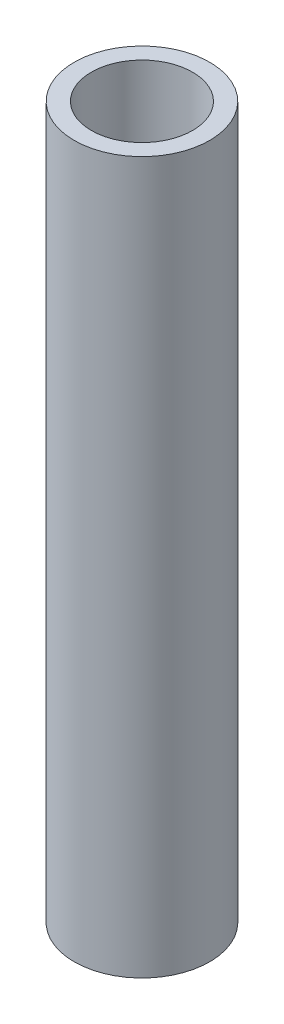
from build123d import *

# Parameters (mm, degrees)
SKETCH1_R           = 9.525
SKETCH1_R_2         = 7.112
BOSS_EXTRUDE1_DEPTH = 100


with BuildPart() as part:
    # Sketch1 → Boss-Extrude1 (new body)
    with BuildSketch(Plane(origin=(0, 0, 0), x_dir=(1, 0, 0), z_dir=(0, 1, 0))):
        with Locations(Location((0, 0, 0), (0, 0, 270))):
            Circle(SKETCH1_R)
        with Locations(Location((0, 0, 0), (0, 0, 270))):
            Circle(SKETCH1_R_2, mode=Mode.SUBTRACT)
    extrude(amount=BOSS_EXTRUDE1_DEPTH)


solid = part.part
